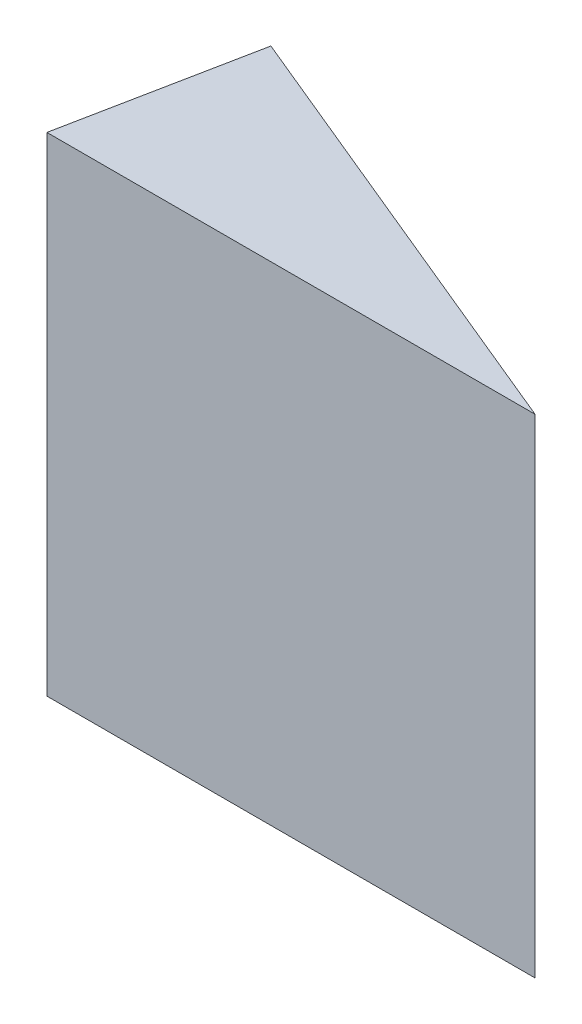
from build123d import *

# Parameters (mm, degrees)
BOSS_EXTRUDE1_DEPTH = 12.7


with BuildPart() as part:
    # Sketch1 → Boss-Extrude1 (new, symmetric)
    with BuildSketch(Plane(origin=(0, 0, 0), x_dir=(1, 0, 0), z_dir=(0, 1, 0))):
        Polygon((12.7, -13.082931372), (-10.766540126, -3.36277219), (-12.7, -13.082931372), align=None)
    extrude(amount=BOSS_EXTRUDE1_DEPTH, both=True)


solid = part.part
